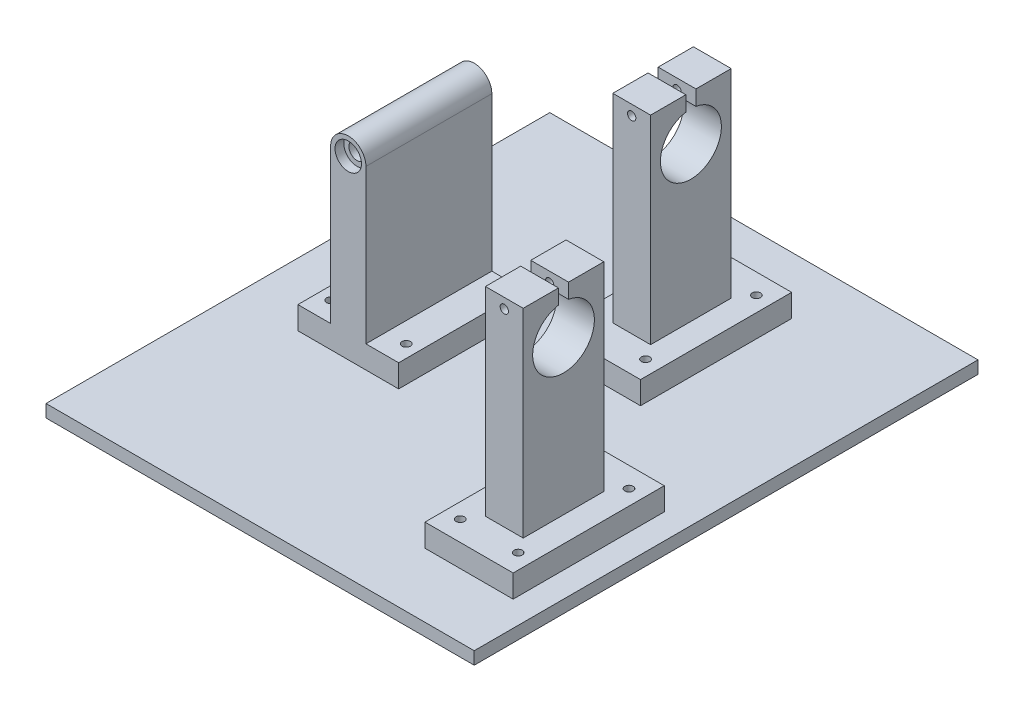
from build123d import *

# Parameters (mm, degrees)
SKETCH_2_W               = 240.549430728
SKETCH_2_H               = 149.540933388
EXTRUDE_1_DEPTH          = 5
SKETCH_6_W               = 93.246571425
SKETCH_6_H               = 149.540933388
EXTRUDE_4_DEPTH          = 5
SKETCH_8_W               = 274.716709757
SKETCH_8_H               = 58.51354913
EXTRUDE_6_DEPTH          = 5
CUT_EXTRUDE_2_DEPTH      = 252.755772101
CUT_EXTRUDE_2_DEPTH_BACK = 252.755772101
SKETCH_9_W               = 59.079292396
SKETCH_9_H               = 149.540933388
SKETCH_10_W              = 104.703380117
SKETCH_10_H              = 208.054482518
CUT_EXTRUDE_3_DEPTH      = 10
SKETCH_12_W              = 200
SKETCH_12_H              = 200
EXTRUDE_7_DEPTH          = 5
SKETCH_13_OUTSIDE_W      = 259.728
SKETCH_13_OUTSIDE_H      = 267.782
SKETCH_13_OUTSIDE_W_2    = 200
SKETCH_13_OUTSIDE_H_2    = 200
CUT_EXTRUDE_4_DEPTH      = 278.64321362
EXTRUDE_START            = -75
SKETCH_18_R              = 5.25
EXTRUDE_9_DEPTH          = 10
EXTRUDE_START_2          = -50
EXTRUDE_10_DEPTH         = 15
EXTRUDE_START_3          = -91.2
EXTRUDE_11_DEPTH         = 15
EXTRUDE_12_REACH         = 286.904
SKETCH_20_R              = 5.25
SKETCH_26_W              = 200
SKETCH_26_H              = 5
EXTRUDE_13_DEPTH         = 100
SKETCH_27_W              = 200
SKETCH_27_H              = 5
CUT_EXTRUDE_5_DEPTH      = 30
EXTRUDE_14_DEPTH         = 10
SKETCH_29_W              = 60
SKETCH_29_H              = 9
EXTRUDE_15_DEPTH         = 10
HOLE_WIZARD_M4_1_D       = 3.3
HOLE_WIZARD_M4_2_D       = 3.3
HOLE_WIZARD_M4_3_D       = 3.3
EXTRUDE_16_DEPTH         = 10
SKETCH_37_W              = 60
SKETCH_37_H              = 9
EXTRUDE_17_DEPTH         = 10
HOLE_WIZARD_M4_4_D       = 3.3
EXTRUDE_START_4          = -3.5
SKETCH_40_R              = 5.25
SKETCH_40_R_2            = 3.25
EXTRUDE_18_DEPTH         = 46.5
CUT_EXTRUDE_START        = -3.5
SKETCH_41_R              = 5.25
SKETCH_41_R_2            = 3.25
CUT_EXTRUDE_6_DEPTH      = 3.5
HOLE_WIZARD_M4_5_D       = 3.3
SKETCH_44_W              = 200
SKETCH_44_H              = 5
CUT_EXTRUDE_7_DEPTH      = 100


with BuildPart() as part:
    # 草图2 → 凸台-拉伸1 (new body)
    with BuildSketch(Plane(origin=(0, 0, 0), x_dir=(1, 0, 0), z_dir=(0, 1, 0))):
        Rectangle(SKETCH_2_W, SKETCH_2_H)
    extrude(amount=EXTRUDE_1_DEPTH)

    # 草图6 → 凸台-拉伸4 (add)
    with BuildSketch(Plane(origin=(0, 5, 0), x_dir=(1, 0, 0), z_dir=(0, 1, 0))):
        with Locations((166.898001077, 0)):
            Rectangle(SKETCH_6_W, SKETCH_6_H)
    extrude(amount=-EXTRUDE_4_DEPTH)

    # 草图8 → 凸台-拉伸6 (add)
    with BuildSketch(Plane(origin=(0, 5, 0), x_dir=(1, 0, 0), z_dir=(0, 1, 0))):
        with Locations((76.162931911, -104.027241259)):
            Rectangle(SKETCH_8_W, SKETCH_8_H)
    extrude(amount=-EXTRUDE_6_DEPTH)

    # 草图9 → 切除-拉伸2 (cut, two sides: drawn at the far end of the back side and taken through both)
    with BuildSketch(Plane(origin=(0, 5, 0), x_dir=(1, 0, 0), z_dir=(0, 1, 0)).offset(-CUT_EXTRUDE_2_DEPTH_BACK)):
        with Locations((-90.735069166, 0)):
            Rectangle(SKETCH_9_W, SKETCH_9_H)
    extrude(amount=CUT_EXTRUDE_2_DEPTH + CUT_EXTRUDE_2_DEPTH_BACK, mode=Mode.SUBTRACT)

    # 草图10 → 切除-拉伸3 (cut)
    with BuildSketch(Plane(origin=(0, 5, 0), x_dir=(1, 0, 0), z_dir=(0, 1, 0))):
        with Locations((-8.84373291, -29.256774565)):
            Rectangle(SKETCH_10_W, SKETCH_10_H)
    extrude(amount=-CUT_EXTRUDE_3_DEPTH, mode=Mode.SUBTRACT)

    # 草图12 → 凸台-拉伸7 (add)
    with BuildSketch(Plane(origin=(0, 5, 0), x_dir=(1, 0, 0), z_dir=(0, 1, 0))):
        with Locations((143.507957149, -25.229533306)):
            Rectangle(SKETCH_12_W, SKETCH_12_H)
    extrude(amount=-EXTRUDE_7_DEPTH)

    # 草图13 outside → 切除-拉伸4 (cut, through all)
    with BuildSketch(Plane(origin=(0, 5, 0), x_dir=(1, 0, 0), z_dir=(0, 1, 0))):
        with Locations((143.508, -29.257)):
            Rectangle(SKETCH_13_OUTSIDE_W, SKETCH_13_OUTSIDE_H)
        with Locations((143.507957149, -25.229533306)):
            Rectangle(SKETCH_13_OUTSIDE_W_2, SKETCH_13_OUTSIDE_H_2, mode=Mode.SUBTRACT)
    extrude(amount=-CUT_EXTRUDE_4_DEPTH, mode=Mode.SUBTRACT)

    # 草图18 → 凸台-拉伸9 (add)
    with BuildSketch(Plane.XY.offset(125.229533306).offset(EXTRUDE_START)):
        with BuildLine():
            Line((95.507957149, 14), (95.507957149, 75))
            ThreePointArc((95.507957149, 75), (88.507957149, 82), (81.507957149, 75))
            Line((81.507957149, 75), (81.507957149, 14))
            Line((81.507957149, 14), (68.507957149, 14))
            Line((68.507957149, 14), (68.507957149, 5))
            Line((68.507957149, 5), (108.507957149, 5))
            Line((108.507957149, 5), (108.507957149, 14))
            Line((108.507957149, 14), (95.507957149, 14))
        make_face()
        with Locations((88.507957149, 75)):
            Circle(SKETCH_18_R, mode=Mode.SUBTRACT)
    extrude_9 = extrude(amount=-EXTRUDE_9_DEPTH)

    # 镜向1: 凸台-拉伸9 across plane
    add(extrude_9.mirror(Plane.XY.offset(25.229533306)))

    # 草图16 → 凸台-拉伸10 (add)
    with BuildSketch(Plane(origin=(243.507957149, 0, 0), x_dir=(0, 0, -1), z_dir=(1, 0, 0)).offset(EXTRUDE_START_2)):
        with BuildLine():
            Line((-53.779533306, 14), (-53.779533306, 93))
            Line((-53.779533306, 93), (-67.779533306, 93))
            Line((-67.779533306, 93), (-67.779533306, 87.085631965))
            ThreePointArc((-67.779533306, 87.085631965), (-69.779533306, 62.75), (-71.779533306, 87.085631965))
            Line((-71.779533306, 87.085631965), (-71.779533306, 93))
            Line((-71.779533306, 93), (-85.779533306, 93))
            Line((-85.779533306, 93), (-85.779533306, 14))
            Line((-85.779533306, 14), (-99.779533306, 14))
            Line((-99.779533306, 14), (-99.779533306, 5))
            Line((-99.779533306, 5), (-39.779533306, 5))
            Line((-39.779533306, 5), (-39.779533306, 14))
            Line((-39.779533306, 14), (-53.779533306, 14))
        make_face()
    extrude(amount=-EXTRUDE_10_DEPTH)

    # 草图19 → 凸台-拉伸11 (add)
    with BuildSketch(Plane(origin=(243.507957149, 0, 0), x_dir=(0, 0, -1), z_dir=(1, 0, 0)).offset(EXTRUDE_START_3)):
        with BuildLine():
            Line((37.990466694, 14), (37.990466694, 92.933566106))
            Line((37.990466694, 92.933566106), (23.990466694, 92.933566106))
            Line((23.990466694, 92.933566106), (23.990466694, 86.933566106))
            ThreePointArc((23.990466694, 86.933566106), (21.990466694, 62.9), (19.990466694, 86.933566106))
            Line((19.990466694, 86.933566106), (19.990466694, 92.933566106))
            Line((19.990466694, 92.933566106), (5.990466694, 92.933566106))
            Line((5.990466694, 92.933566106), (5.990466694, 14))
            Line((5.990466694, 14), (-8.009533306, 14))
            Line((-8.009533306, 14), (-8.009533306, 5))
            Line((-8.009533306, 5), (51.990466694, 5))
            Line((51.990466694, 5), (51.990466694, 14))
            Line((51.990466694, 14), (37.990466694, 14))
        make_face()
    extrude(amount=-EXTRUDE_11_DEPTH)

    # 草图20 → 凸台-拉伸12 (add, up to next)
    with BuildSketch(Plane(origin=(0, 0, 40.229533306), x_dir=(-1, 0, 0), z_dir=(0, 0, -1)), mode=Mode.PRIVATE) as extrude_12_sk1:
        with BuildLine():
            Line((-108.507957149, 5), (-68.507957149, 5))
            Line((-68.507957149, 5), (-68.507957149, 14))
            Line((-68.507957149, 14), (-81.507957149, 14))
            Line((-81.507957149, 14), (-81.507957149, 75))
            ThreePointArc((-81.507957149, 75), (-88.507957149, 82), (-95.507957149, 75))
            Line((-95.507957149, 75), (-95.507957149, 14))
            Line((-95.507957149, 14), (-108.507957149, 14))
            Line((-108.507957149, 14), (-108.507957149, 5))
        make_face()
        with Locations(Location((-88.507957149, 75, 0), (0, 0, 180))):
            Circle(SKETCH_20_R, mode=Mode.SUBTRACT)
    extrude_12_tool1 = extrude(extrude_12_sk1.sketch, amount=EXTRUDE_12_REACH, mode=Mode.PRIVATE) - part.part
    add(extrude_12_tool1.solids().sort_by_distance((88.507957, 33.984391, 40.229533))[0])

    # 草图26 → 凸台-拉伸13 (add)
    with BuildSketch(Plane(origin=(243.507957149, 0, 0), x_dir=(0, 0, -1), z_dir=(1, 0, 0))):
        with Locations((-25.229533306, 2.5)):
            Rectangle(SKETCH_26_W, SKETCH_26_H)
    extrude(amount=EXTRUDE_13_DEPTH)

    # 草图27 → 切除-拉伸5 (cut)
    with BuildSketch(Plane(origin=(343.507957149, 0, 0), x_dir=(0, 0, -1), z_dir=(1, 0, 0))):
        with Locations((-25.229533306, 2.5)):
            Rectangle(SKETCH_27_W, SKETCH_27_H)
    extrude(amount=-CUT_EXTRUDE_5_DEPTH, mode=Mode.SUBTRACT)

    # 草图28 → 凸台-拉伸14 (add)
    with BuildSketch(Plane(origin=(193.507957149, 0, 0), x_dir=(0, 0, -1), z_dir=(1, 0, 0))):
        Polygon((-85.779533306, 14), (-53.779533306, 14), (-39.779533306, 14), (-39.779533306, 5), (-99.779533306, 5), (-99.779533306, 14), align=None)
    extrude(amount=EXTRUDE_14_DEPTH)

    # 草图29 → 凸台-拉伸15 (add)
    with BuildSketch(Plane.ZY.offset(-178.507957149)):
        with Locations((69.779533306, 9.5)):
            Rectangle(SKETCH_29_W, SKETCH_29_H)
    extrude(amount=EXTRUDE_15_DEPTH)

    # M4 螺纹孔1 (through all)
    with Locations(Plane(origin=(0, 14, 0), x_dir=(1, 0, 0), z_dir=(0, 1, 0))):
        with Locations((174.507957149, -47.779533306), (197.507957149, -47.779533306), (197.507957149, -91.779533306), (174.507957149, -91.779533306)):
            Hole(HOLE_WIZARD_M4_1_D / 2)

    # M4 螺纹孔2 (through all)
    with Locations(Plane.XY.offset(85.779533306)):
        with Locations((186.007957149, 89)):
            Hole(HOLE_WIZARD_M4_2_D / 2)

    # M4 螺纹孔3 (through all)
    with Locations(Plane.XY.offset(-5.990466694)):
        with Locations((144.807957149, 88.933566106)):
            Hole(HOLE_WIZARD_M4_3_D / 2)

    # 草图36 → 凸台-拉伸16 (add)
    with BuildSketch(Plane(origin=(152.307957149, 0, 0), x_dir=(0, 0, -1), z_dir=(1, 0, 0))):
        Polygon((5.990466694, 14), (37.990466694, 14), (51.990466694, 14), (51.990466694, 5), (-8.009533306, 5), (-8.009533306, 14), align=None)
    extrude(amount=EXTRUDE_16_DEPTH)

    # 草图37 → 凸台-拉伸17 (add)
    with BuildSketch(Plane.ZY.offset(-137.307957149)):
        with Locations((-21.990466694, 9.5)):
            Rectangle(SKETCH_37_W, SKETCH_37_H)
    extrude(amount=EXTRUDE_17_DEPTH)

    # M4 螺纹孔4 (through all)
    with Locations(Plane(origin=(0, 14, 0), x_dir=(1, 0, 0), z_dir=(0, 1, 0))):
        with Locations((133.307957149, 43.990466694), (156.307957149, 43.990466694), (156.307957149, -0.009533306), (133.307957149, -0.009533306)):
            Hole(HOLE_WIZARD_M4_4_D / 2)

    # 草图40 → 凸台-拉伸18 (add)
    with BuildSketch(Plane.XY.offset(50.229533306).offset(EXTRUDE_START_4)):
        with Locations((88.507957149, 75)):
            Circle(SKETCH_40_R)
        with Locations((88.507957149, 75)):
            Circle(SKETCH_40_R_2, mode=Mode.SUBTRACT)
    extrude(amount=-EXTRUDE_18_DEPTH)

    # 草图41 → 切除-拉伸6 (cut)
    with BuildSketch(Plane(origin=(0, 0, 0.229533306), x_dir=(-1, 0, 0), z_dir=(0, 0, -1)).offset(CUT_EXTRUDE_START)):
        with Locations(Location((-88.507957149, 75, 0), (0, 0, 180))):
            Circle(SKETCH_41_R)
        with Locations(Location((-88.507957149, 75, 0), (0, 0, 180))):
            Circle(SKETCH_41_R_2, mode=Mode.SUBTRACT)
    extrude(amount=CUT_EXTRUDE_6_DEPTH, mode=Mode.SUBTRACT)

    # M4 螺纹孔5 (through all)
    with Locations(Plane(origin=(0, 14, 0), x_dir=(1, 0, 0), z_dir=(0, 1, 0))):
        with Locations((73.507957149, -8.229533306), (103.507957149, -8.229533306), (103.507957149, -42.229533306), (73.507957149, -42.229533306)):
            Hole(HOLE_WIZARD_M4_5_D / 2)

    # 草图44 → 切除-拉伸7 (cut)
    with BuildSketch(Plane(origin=(313.507957149, 0, 0), x_dir=(0, 0, -1), z_dir=(1, 0, 0))):
        with Locations((-25.229533306, 2.5)):
            Rectangle(SKETCH_44_W, SKETCH_44_H)
    extrude(amount=-CUT_EXTRUDE_7_DEPTH, mode=Mode.SUBTRACT)


solid = part.part
